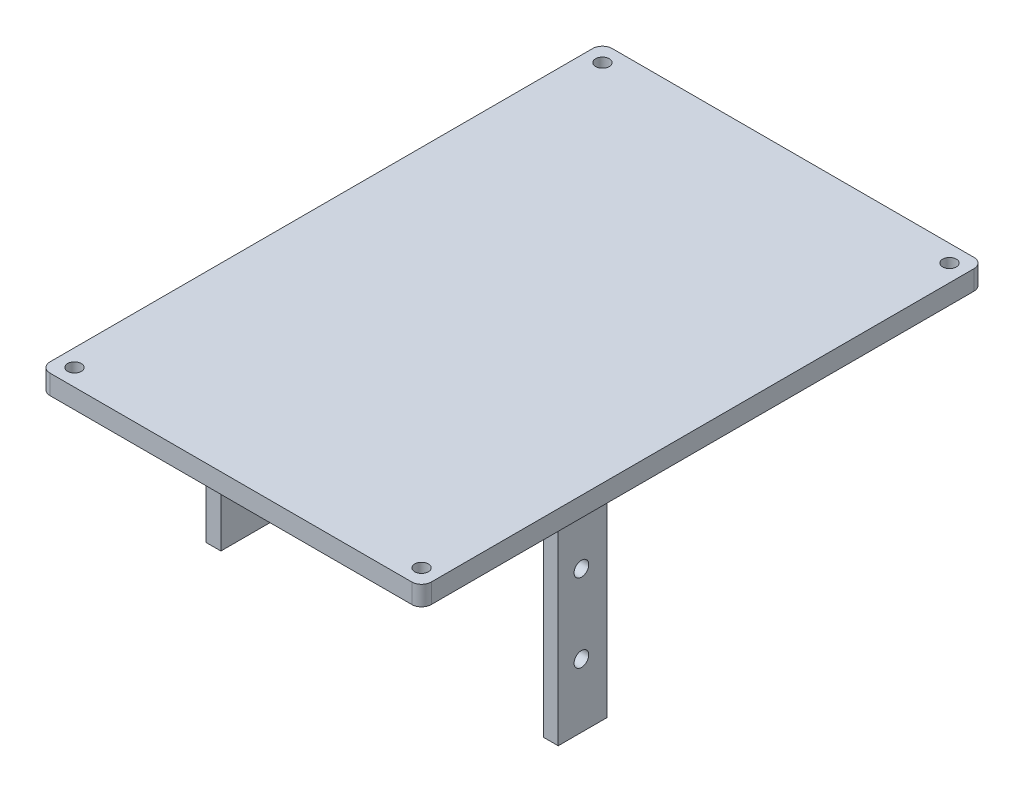
from build123d import *

# Parameters (mm, degrees)
SKETCH1_W           = 78
SKETCH1_H           = 115
BOSS_EXTRUDE1_DEPTH = 4
SKETCH5_R           = 1.4
CUT_EXTRUDE3_DEPTH  = 2
SKETCH6_W           = 3
SKETCH6_H           = 10
BOSS_EXTRUDE3_DEPTH = 41
SKETCH7_R           = 1.5
CUT_EXTRUDE4_DEPTH  = 104.015775491
FILLET1_R           = 2


with BuildPart() as part:
    # Sketch1 → Boss-Extrude1 (new body)
    with BuildSketch(Plane(origin=(0, 0, 0), x_dir=(1, 0, 0), z_dir=(0, 1, 0))):
        Rectangle(SKETCH1_W, SKETCH1_H)
    extrude(amount=BOSS_EXTRUDE1_DEPTH)

    # Sketch5 → Cut-Extrude3 (cut)
    with BuildSketch(Plane(origin=(0, 4, 0), x_dir=(1, 0, 0), z_dir=(0, 1, 0))):
        with Locations(Location((-35.5, 54, 0), (0, 0, 270))):
            Circle(SKETCH5_R)
        with Locations(Location((35.5, 54, 0), (0, 0, 270))):
            Circle(SKETCH5_R)
        with Locations(Location((35.5, -54, 0), (0, 0, 90))):
            Circle(SKETCH5_R)
        with Locations(Location((-35.5, -54, 0), (0, 0, 90))):
            Circle(SKETCH5_R)
    extrude(amount=-CUT_EXTRUDE3_DEPTH, mode=Mode.SUBTRACT)

    # Sketch6 → Boss-Extrude3 (add)
    with BuildSketch(Plane.XZ):
        with Locations((-34.5, 21.55)):
            Rectangle(SKETCH6_W, SKETCH6_H)
        with Locations((34.5, 21.55)):
            Rectangle(SKETCH6_W, SKETCH6_H)
    extrude(amount=BOSS_EXTRUDE3_DEPTH)

    # Sketch7 → Cut-Extrude4 (cut, through all)
    with BuildSketch(Plane(origin=(36, 0, 0), x_dir=(0, 0, -1), z_dir=(1, 0, 0))):
        with Locations((-21.8, -12)):
            Circle(SKETCH7_R)
        with Locations((-21.8, -28)):
            Circle(SKETCH7_R)
    extrude(amount=-CUT_EXTRUDE4_DEPTH, mode=Mode.SUBTRACT)

    # Fillet1
    fillet1_edges = [part.edges().sort_by_distance(p)[0] for p in [
        (-39, 2, -57.5),
        (39, 2, -57.5),
        (39, 2, 57.5),
        (-39, 2, 57.5),
    ]]
    fillet(fillet1_edges, radius=FILLET1_R)


solid = part.part
